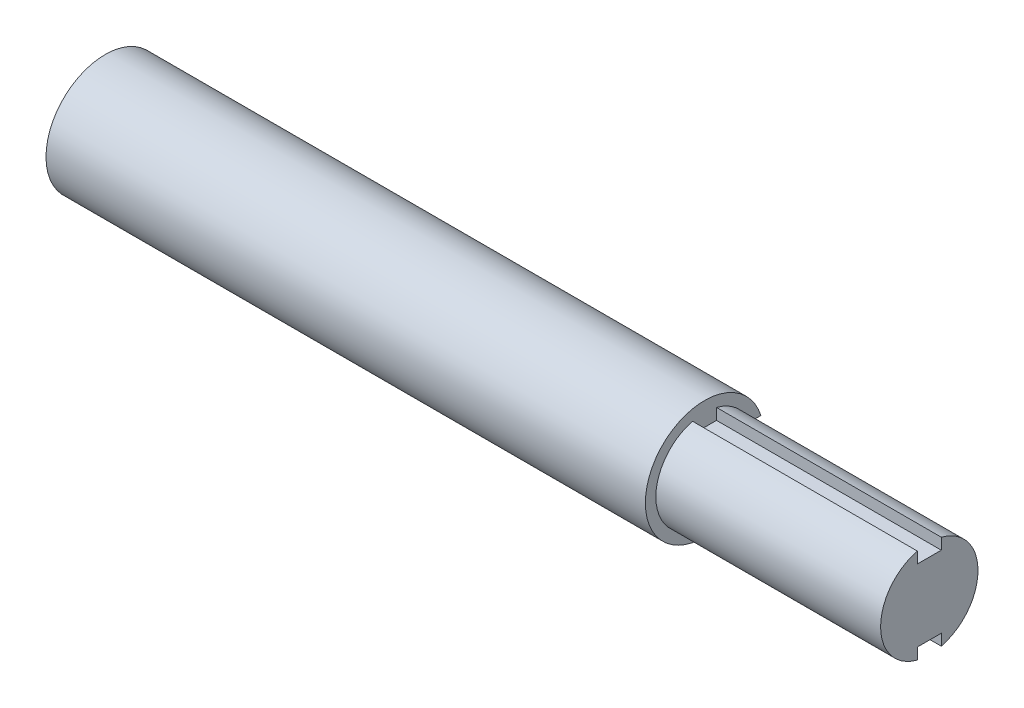
from build123d import *

# Parameters (mm, degrees)
SKETCH1_R           = 6.5
BOSS_EXTRUDE1_DEPTH = 30
SKETCH2_R           = 7.9
BOSS_EXTRUDE2_DEPTH = 80
SKETCH3_W           = 3.2
SKETCH3_H           = 2
CUT_EXTRUDE2_DEPTH  = 30
SKETCH5_W           = 3
SKETCH5_H           = 4.8
CUT_EXTRUDE3_DEPTH  = 80


with BuildPart() as part:
    # Sketch1 → Boss-Extrude1 (new body)
    with BuildSketch(Plane(origin=(0, 0, 0), x_dir=(0, 0, -1), z_dir=(1, 0, 0))):
        Circle(SKETCH1_R)
    extrude(amount=BOSS_EXTRUDE1_DEPTH)

    # Sketch2 → Boss-Extrude2 (add)
    with BuildSketch(Plane.ZY):
        Circle(SKETCH2_R)
    extrude(amount=BOSS_EXTRUDE2_DEPTH)

    # Sketch3 → Cut-Extrude2 (cut)
    with BuildSketch(Plane(origin=(30, 0, 0), x_dir=(0, 0, -1), z_dir=(1, 0, 0))):
        with Locations((0, 5.8)):
            Rectangle(SKETCH3_W, SKETCH3_H)
        with Locations((0, -5.8)):
            Rectangle(SKETCH3_W, SKETCH3_H)
    extrude(amount=-CUT_EXTRUDE2_DEPTH, mode=Mode.SUBTRACT)

    # Sketch5 → Cut-Extrude3 (cut)
    with BuildSketch(Plane.ZY.offset(80)):
        with Locations((-6.626619427, 0)):
            Rectangle(SKETCH5_W, SKETCH5_H)
    extrude(amount=-CUT_EXTRUDE3_DEPTH, mode=Mode.SUBTRACT)


solid = part.part
